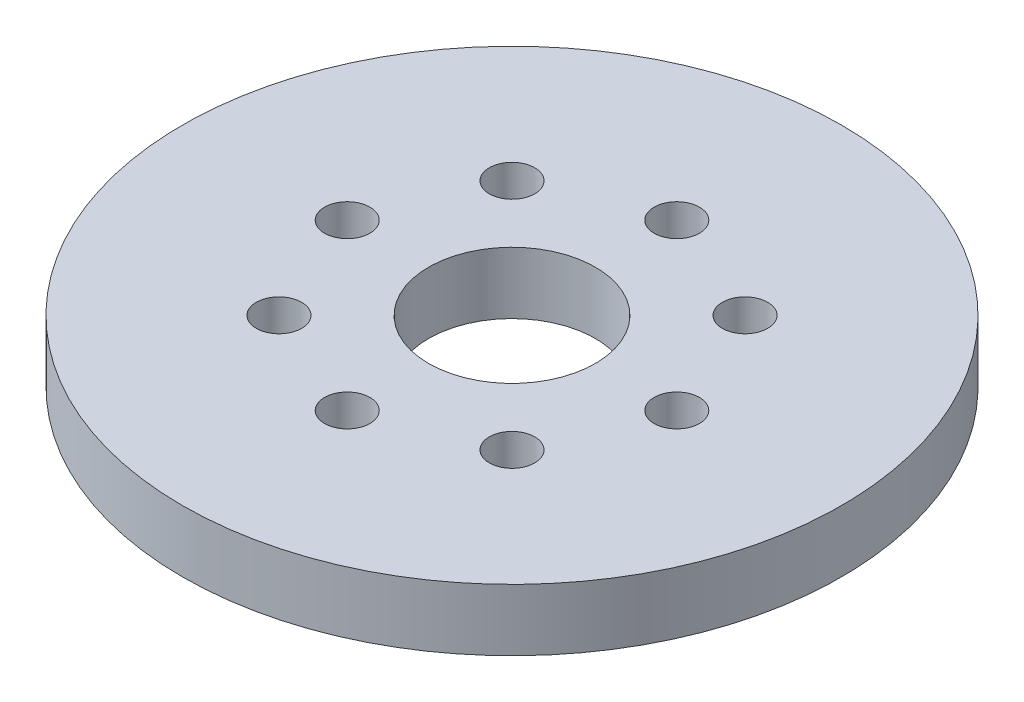
from build123d import *

# Parameters (mm, degrees)
SKETCH1_R           = 16
SKETCH1_R_2         = 4.05
SKETCH1_R_3         = 1.1
BOSS_EXTRUDE1_DEPTH = 3


with BuildPart() as part:
    # Sketch1 → Boss-Extrude1 (new body)
    with BuildSketch(Plane(origin=(0, 0, 0), x_dir=(1, 0, 0), z_dir=(0, 1, 0))):
        with Locations(Location((0, 0, 0), (0, 0, 270))):
            Circle(SKETCH1_R)
        with Locations(Location((0, 0, 0), (0, 0, 270))):
            Circle(SKETCH1_R_2, mode=Mode.SUBTRACT)
        with Locations(Location((0, 8, 0), (0, 0, 270))):
            Circle(SKETCH1_R_3, mode=Mode.SUBTRACT)
        with Locations(Location((5.656854249, 5.656854249, 0), (0, 0, 270))):
            Circle(SKETCH1_R_3, mode=Mode.SUBTRACT)
        with Locations(Location((8, 0, 0), (0, 0, 270))):
            Circle(SKETCH1_R_3, mode=Mode.SUBTRACT)
        with Locations(Location((5.656854249, -5.656854249, 0), (0, 0, 270))):
            Circle(SKETCH1_R_3, mode=Mode.SUBTRACT)
        with Locations(Location((0, -8, 0), (0, 0, 270))):
            Circle(SKETCH1_R_3, mode=Mode.SUBTRACT)
        with Locations(Location((-5.656854249, -5.656854249, 0), (0, 0, 270))):
            Circle(SKETCH1_R_3, mode=Mode.SUBTRACT)
        with Locations(Location((-8, 0, 0), (0, 0, 270))):
            Circle(SKETCH1_R_3, mode=Mode.SUBTRACT)
        with Locations(Location((-5.656854249, 5.656854249, 0), (0, 0, 270))):
            Circle(SKETCH1_R_3, mode=Mode.SUBTRACT)
    extrude(amount=BOSS_EXTRUDE1_DEPTH)


solid = part.part
